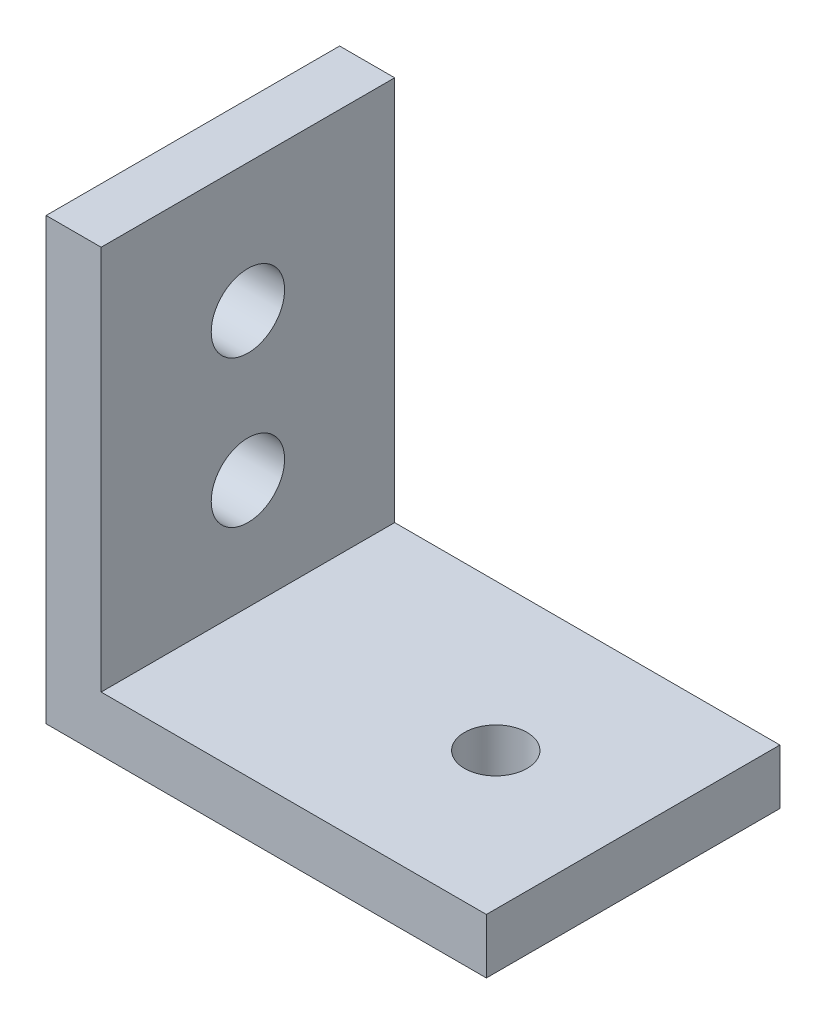
from build123d import *

# Parameters (mm, degrees)
BOSS_EXTRUDE1_DEPTH     = 25.4
CUT_EXTRUDE1_REACH      = 51.636
SKETCH2_R               = 3.175
F_1_4_28_TAPPED_HOLE1_D = 5.4102


with BuildPart() as part:
    # Sketch1 → Boss-Extrude1 (new body)
    with BuildSketch(Plane.XY):
        Polygon((-23.771121012, 18.943273067), (-23.771121012, -19.156726933), (14.328878988, -19.156726933), (14.328878988, -14.394226933), (-19.008621012, -14.394226933), (-19.008621012, 18.943273067), align=None)
    extrude(amount=BOSS_EXTRUDE1_DEPTH)

    # Sketch2 → Cut-Extrude1 (cut, up to next)
    with BuildSketch(Plane.ZY.offset(23.771121012), mode=Mode.PRIVATE) as cut_extrude1_sk1:
        with Locations(Location((12.7, 7.830773067, 0), (0, 0, 270))):
            Circle(SKETCH2_R)
    cut_extrude1_tool1 = extrude(cut_extrude1_sk1.sketch, amount=-CUT_EXTRUDE1_REACH, mode=Mode.PRIVATE) & part.part
    # Sketch2 → Cut-Extrude1 (cut, up to next)
    with BuildSketch(Plane.ZY.offset(23.771121012), mode=Mode.PRIVATE) as cut_extrude1_sk2:
        with Locations(Location((12.7, -4.869226933, 0), (0, 0, 270))):
            Circle(SKETCH2_R)
    cut_extrude1_tool2 = extrude(cut_extrude1_sk2.sketch, amount=-CUT_EXTRUDE1_REACH, mode=Mode.PRIVATE) & part.part
    add(cut_extrude1_tool1.solids().sort_by_distance((-23.771121, 7.830773, 12.7))[0], mode=Mode.SUBTRACT)
    add(cut_extrude1_tool2.solids().sort_by_distance((-23.771121, -4.869227, 12.7))[0], mode=Mode.SUBTRACT)

    # 1/4-28 Tapped Hole1 (through all)
    with Locations(Plane(origin=(0, -19.156726933, 0), x_dir=(-1, 0, 0), z_dir=(0, -1, 0))):
        with Locations((-2.441678988, -12.7)):
            Hole(F_1_4_28_TAPPED_HOLE1_D / 2)


solid = part.part
